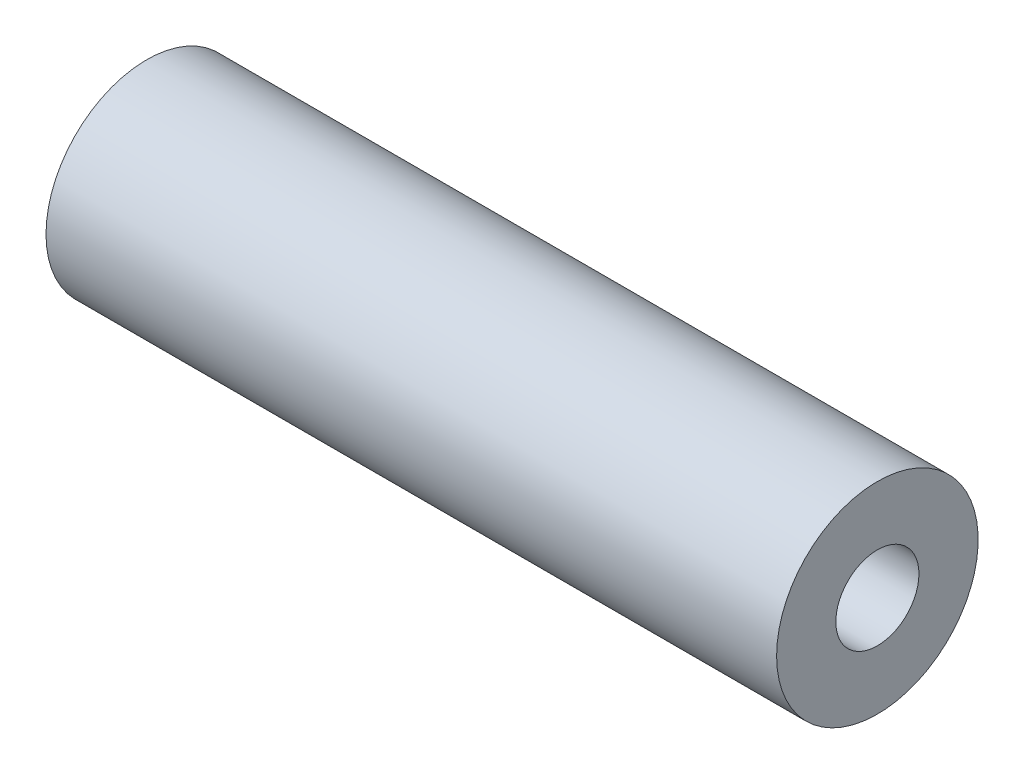
from build123d import *

# Parameters (mm, degrees)
SKETCH1_R           = 4
BOSS_EXTRUDE1_DEPTH = 14.5
M4_TAPPED_HOLE1_D   = 3.3


with BuildPart() as part:
    # Sketch1 → Boss-Extrude1 (new, symmetric)
    with BuildSketch(Plane(origin=(0, 0, 0), x_dir=(0, 0, -1), z_dir=(1, 0, 0))):
        with Locations(Location((0, 0, 0), (0, 0, 180))):
            Circle(SKETCH1_R)
    extrude(amount=BOSS_EXTRUDE1_DEPTH, both=True)

    # M4 Tapped Hole1 (through all)
    with Locations(Plane(origin=(14.5, 0, 0), x_dir=(0, 0, -1), z_dir=(1, 0, 0))):
        with Locations((0, 0)):
            Hole(M4_TAPPED_HOLE1_D / 2)


solid = part.part
